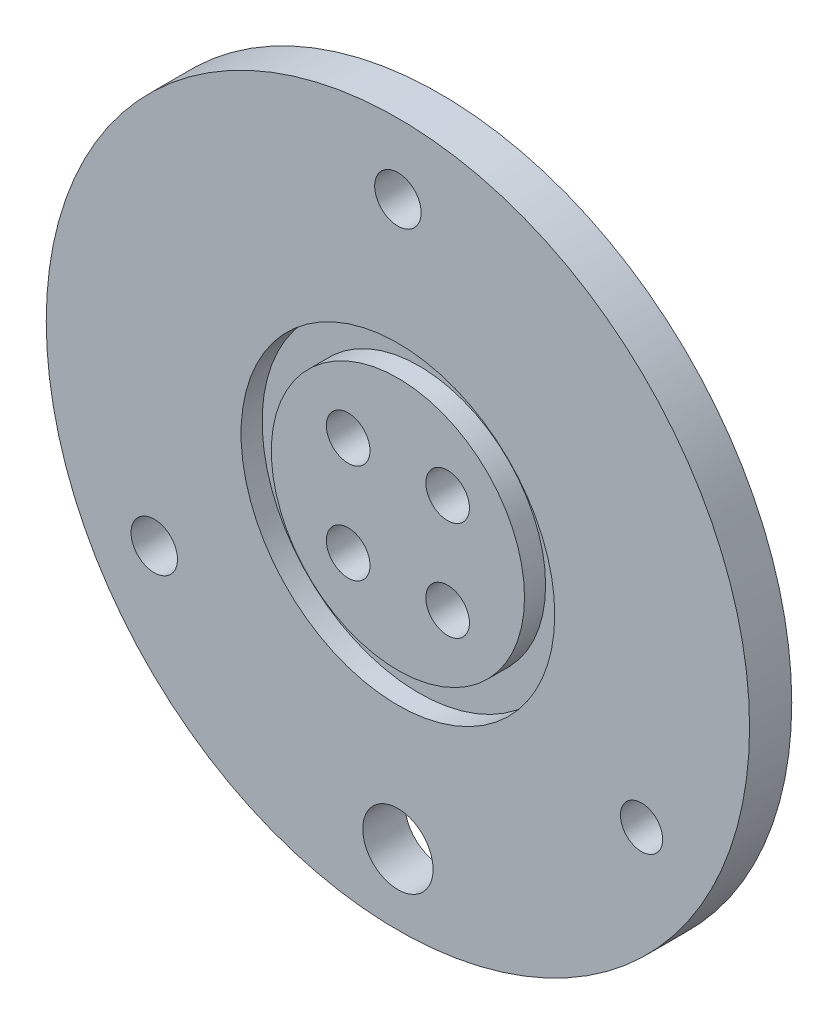
from build123d import *

# Parameters (mm, degrees)
SKETCH_1_R          = 25
SKETCH_1_R_2        = 2.5
SKETCH_1_R_3        = 1.65
SKETCH_1_R_4        = 1.5
SKETCH_1_R_5        = 11.05
EXTRUDE_1_DEPTH     = 3
SKETCH_2_R          = 11.15
SKETCH_2_R_2        = 9
CUT_EXTRUDE_1_DEPTH = 1.5
SKETCH_4_R          = 1.55
CUT_EXTRUDE_2_DEPTH = 36.482389998


with BuildPart() as part:
    # 草图1 → 凸台-拉伸1 (new body)
    # profile 1 of 2: a face of its own
    with BuildSketch(Plane.XY):
        Circle(SKETCH_1_R)
        with Locations((0, -20)):
            Circle(SKETCH_1_R_2, mode=Mode.SUBTRACT)
        with Locations((0, 20)):
            Circle(SKETCH_1_R_3, mode=Mode.SUBTRACT)
        with Locations((-17.320508076, -10)):
            Circle(SKETCH_1_R_3, mode=Mode.SUBTRACT)
        with Locations((17.320508076, -10)):
            Circle(SKETCH_1_R_4, mode=Mode.SUBTRACT)
        Circle(SKETCH_1_R_5, mode=Mode.SUBTRACT)
    # profile 2 of 2: a face of its own
    with BuildSketch(Plane.XY):
        Circle(SKETCH_1_R_5)
    extrude(amount=EXTRUDE_1_DEPTH)

    # 草图2 → 切除-拉伸1 (cut)
    with BuildSketch(Plane.XY.offset(3)):
        Circle(SKETCH_2_R)
        Circle(SKETCH_2_R_2, mode=Mode.SUBTRACT)
    extrude(amount=-CUT_EXTRUDE_1_DEPTH, mode=Mode.SUBTRACT)

    # 草图4 → 切除-拉伸2 (cut, through all)
    with BuildSketch(Plane.XY.offset(3)):
        with Locations((-3.535533906, 3.535533906)):
            Circle(SKETCH_4_R)
        with Locations((3.535533906, 3.535533906)):
            Circle(SKETCH_4_R)
        with Locations((3.535533906, -3.535533906)):
            Circle(SKETCH_4_R)
        with Locations((-3.535533906, -3.535533906)):
            Circle(SKETCH_4_R)
    extrude(amount=-CUT_EXTRUDE_2_DEPTH, mode=Mode.SUBTRACT)


solid = part.part
